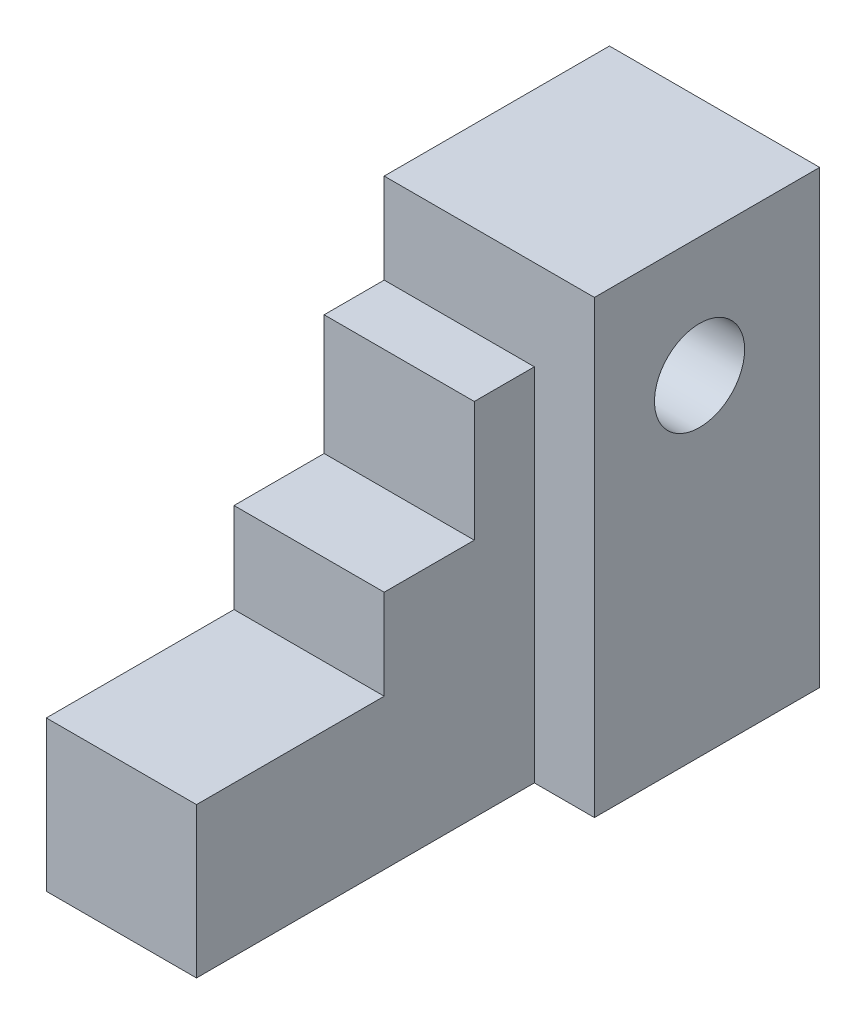
from build123d import *

# Parameters (mm, degrees)
BOSS_EXTRUDE2_DEPTH = 28
CUT_EXTRUDE2_START  = 28
CUT_EXTRUDE2_DEPTH  = 8
SKETCH4_R           = 6
CUT_EXTRUDE3_DEPTH  = 28


with BuildPart() as part:
    # Sketch2 → Boss-Extrude2 (new body)
    with BuildSketch(Plane.YZ):
        Polygon((0, 0), (60, 0), (60, 30), (48, 30), (48, 38), (32, 38), (32, 50), (20, 50), (20, 75), (0, 75), align=None)
    extrude(amount=BOSS_EXTRUDE2_DEPTH)

    # Sketch3 → Cut-Extrude2 (cut)
    with BuildSketch(Plane.YZ.offset(CUT_EXTRUDE2_START)):
        Polygon((48, 30), (0, 30), (0, 75), (20, 75), (20, 50), (32, 50), (32, 38), (48, 38), align=None)
    extrude(amount=-CUT_EXTRUDE2_DEPTH, mode=Mode.SUBTRACT)

    # Sketch4 → Cut-Extrude3 (cut)
    with BuildSketch(Plane.YZ):
        with Locations(Location((44, 16, 0), (0, 0, 270))):
            Circle(SKETCH4_R)
    extrude(amount=CUT_EXTRUDE3_DEPTH, mode=Mode.SUBTRACT)


solid = part.part
